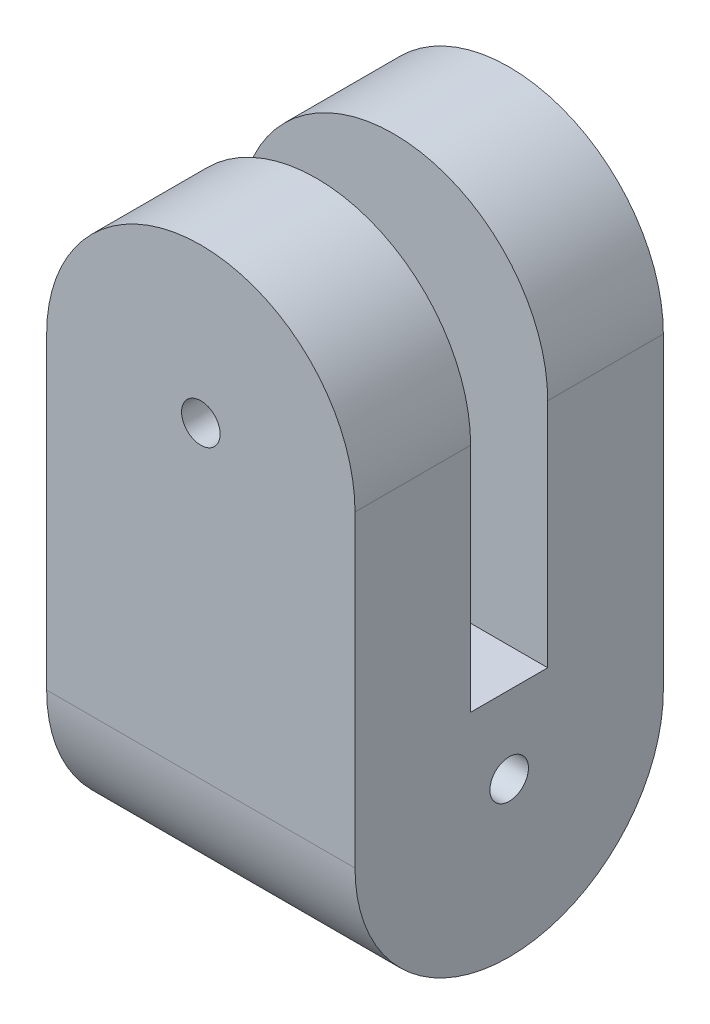
from build123d import *

# Parameters (mm, degrees)
BOSS_EXTRUDE2_DEPTH     = 20
CUT_EXTRUDE2_DEPTH      = 42.231056256
CUT_EXTRUDE2_DEPTH_BACK = 42.231056256
SKETCH4_W               = 5
SKETCH4_H               = 25
CUT_EXTRUDE3_DEPTH      = 42.231056256
CUT_EXTRUDE3_DEPTH_BACK = 42.231056256
SKETCH5_R               = 1.25
BOSS_EXTRUDE3_DEPTH     = 20
CUT_EXTRUDE4_DEPTH      = 42.231056256
CUT_EXTRUDE4_DEPTH_BACK = 42.231056256
SKETCH7_R               = 1.25


with BuildPart() as part:
    # Sketch3 → Boss-Extrude2 (new body)
    with BuildSketch(Plane.XY):
        with BuildLine():
            Line((0, 0), (20, 0))
            Line((20, 0), (20, 20))
            ThreePointArc((20, 20), (10, 30), (0, 20))
            Line((0, 20), (0, 0))
        make_face()
    extrude(amount=BOSS_EXTRUDE2_DEPTH)

    # Sketch4 → Cut-Extrude2 (cut, two sides: drawn at the far end of the back side and taken through both)
    with BuildSketch(Plane(origin=(20, 0, 0), x_dir=(0, 0, -1), z_dir=(1, 0, 0)).offset(-CUT_EXTRUDE2_DEPTH_BACK)):
        with Locations((-10, 17.5)):
            Rectangle(SKETCH4_W, SKETCH4_H)
    extrude(amount=CUT_EXTRUDE2_DEPTH + CUT_EXTRUDE2_DEPTH_BACK, mode=Mode.SUBTRACT)

    # Sketch5 → Cut-Extrude3 (cut, two sides: drawn at the far end of the back side and taken through both)
    with BuildSketch(Plane(origin=(0, 0, 0), x_dir=(-1, 0, 0), z_dir=(0, 0, -1)).offset(-CUT_EXTRUDE3_DEPTH_BACK)):
        with Locations((-10, 20)):
            Circle(SKETCH5_R)
    extrude(amount=CUT_EXTRUDE3_DEPTH + CUT_EXTRUDE3_DEPTH_BACK, mode=Mode.SUBTRACT)

    # Sketch6 → Boss-Extrude3 (add)
    with BuildSketch(Plane(origin=(20, 0, 0), x_dir=(0, 0, -1), z_dir=(1, 0, 0))):
        with BuildLine():
            Line((-20, 0), (0, 0))
            ThreePointArc((0, 0), (-10, -10), (-20, 0))
        make_face()
    extrude(amount=-BOSS_EXTRUDE3_DEPTH)

    # Sketch7 → Cut-Extrude4 (cut, two sides: drawn at the far end of the back side and taken through both)
    with BuildSketch(Plane(origin=(20, 0, 0), x_dir=(0, 0, -1), z_dir=(1, 0, 0)).offset(-CUT_EXTRUDE4_DEPTH_BACK)):
        with Locations((-10, 0)):
            Circle(SKETCH7_R)
    extrude(amount=CUT_EXTRUDE4_DEPTH + CUT_EXTRUDE4_DEPTH_BACK, mode=Mode.SUBTRACT)


solid = part.part
